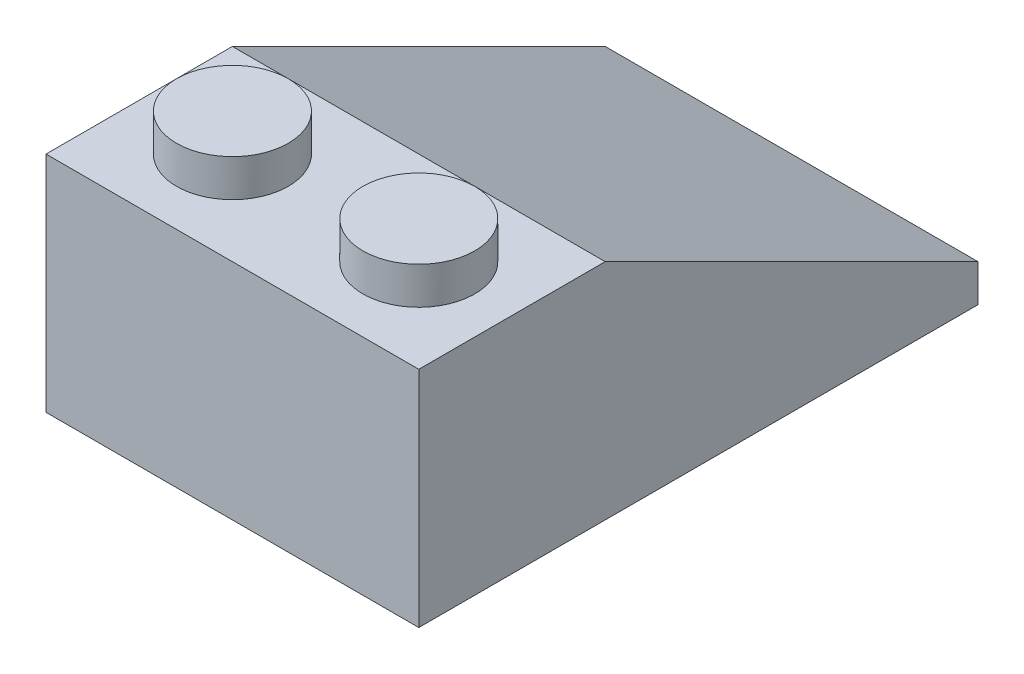
from build123d import *

# Parameters (mm, degrees)
BOSS_EXTRUDE1_DEPTH = 16
SKETCH2_R           = 2.4
BOSS_EXTRUDE2_DEPTH = 1.6
SHELL1_T            = -1.6


with BuildPart() as part:
    # Sketch1 → Boss-Extrude1 (new body)
    with BuildSketch(Plane(origin=(0, 0, 0), x_dir=(0, 0, -1), z_dir=(1, 0, 0))):
        Polygon((0, 0), (24, 0), (24, 1.6), (8, 9.6), (0, 9.6), align=None)
    extrude(amount=BOSS_EXTRUDE1_DEPTH)

    # Sketch2 → Boss-Extrude2 (add)
    with BuildSketch(Plane(origin=(0, 9.6, 0), x_dir=(1, 0, 0), z_dir=(0, 1, 0))):
        with Locations(Location((4, 4, 0), (0, 0, 90))):
            Circle(SKETCH2_R)
        with Locations(Location((12, 4, 0), (0, 0, 90))):
            Circle(SKETCH2_R)
    extrude(amount=BOSS_EXTRUDE2_DEPTH)

    # Shell1
    shell1_openings = [part.faces().sort_by_distance(p)[0] for p in [
        (8, 0, -12),
    ]]
    offset(amount=SHELL1_T, openings=shell1_openings, kind=Kind.INTERSECTION)


solid = part.part
